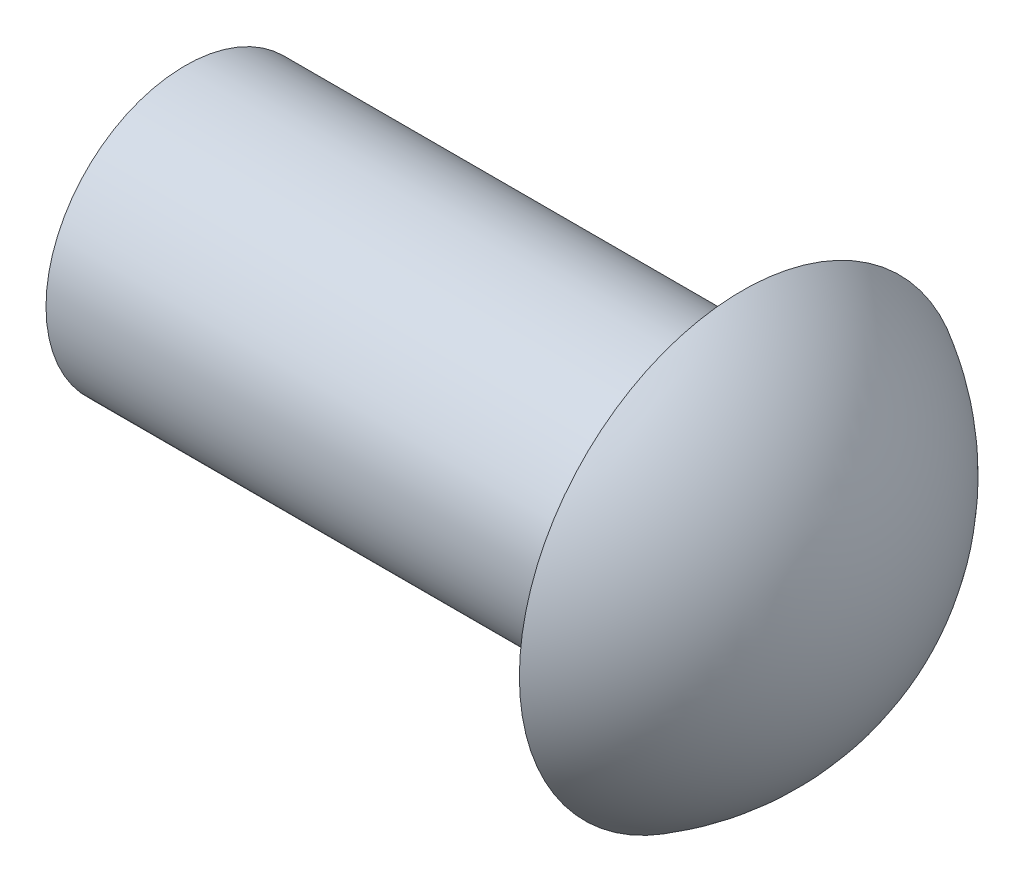
from build123d import *


with BuildPart() as part:
    # Sketch1 → Revolve1 (revolve)
    with BuildSketch(Plane(origin=(0, 0, 0), x_dir=(1, 0, 0), z_dir=(0, 1, 0)), mode=Mode.PRIVATE) as revolve1_sk:
        with BuildLine():
            Line((0, 0), (0, 7.5))
            Line((0, 7.5), (30, 7.5))
            Line((30, 7.5), (30, 12))
            ThreePointArc((30, 12), (35.122094848, 6.946221995), (37, 0))
            Line((37, 0), (0, 0))
        make_face()
    revolve(revolve1_sk.sketch.rotate(Axis((0, 0, 0), (1, 0, 0)), 180), axis=Axis((0, 0, 0), (1, 0, 0)))


solid = part.part
